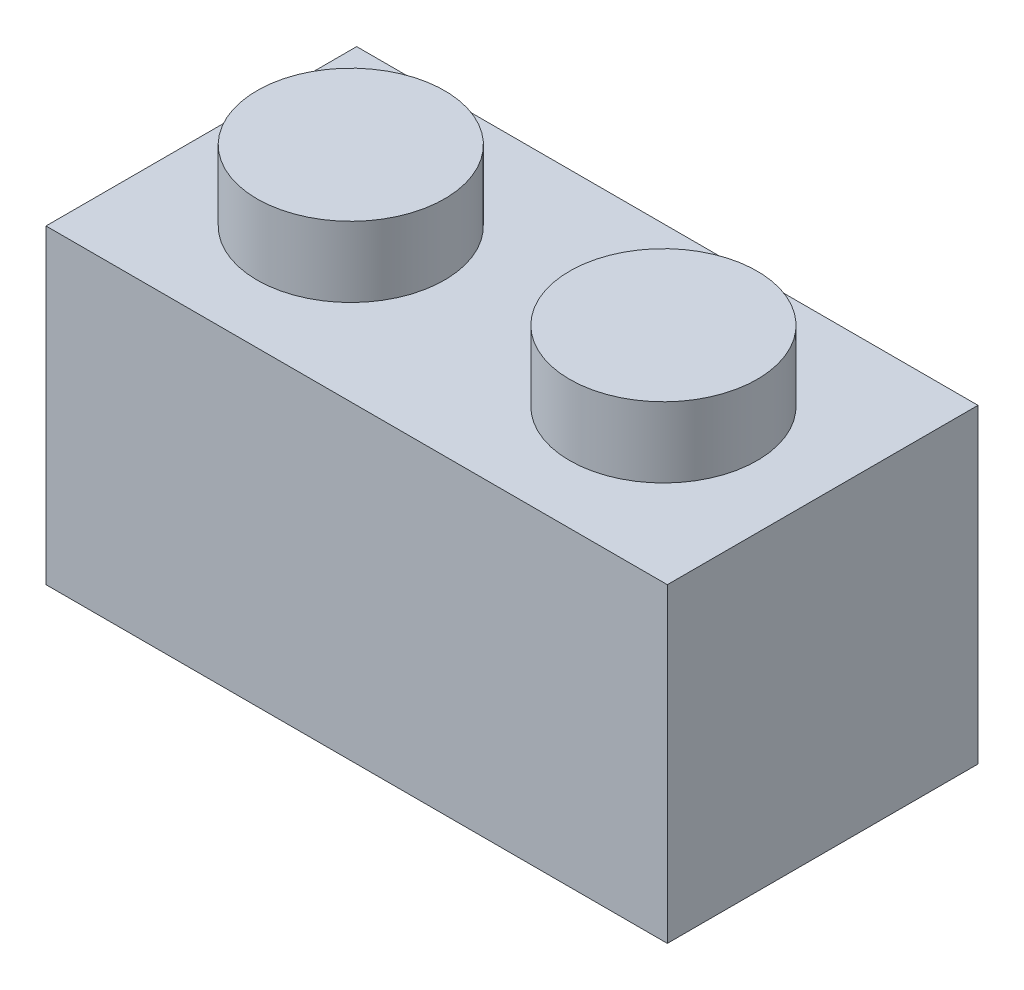
from build123d import *

# Parameters (mm, degrees)
SKETCH1_W           = 15.9
SKETCH1_H           = 7.95
BOSS_EXTRUDE1_DEPTH = 7.95
SKETCH2_R           = 2.4
BOSS_EXTRUDE2_DEPTH = 1.8
LPATTERN1_COUNT     = 2
LPATTERN1_PITCH     = 8
SHELL1_T            = -1.2


with BuildPart() as part:
    # Sketch1 → Boss-Extrude1 (new body)
    with BuildSketch(Plane.XY):
        Rectangle(SKETCH1_W, SKETCH1_H)
    extrude(amount=-BOSS_EXTRUDE1_DEPTH)

    # Sketch2 → Boss-Extrude2 (add)
    with BuildSketch(Plane(origin=(0, 3.975, 0), x_dir=(1, 0, 0), z_dir=(0, 1, 0))):
        with Locations(Location((-4.05, 3.9, 0), (0, 0, 270))):
            Circle(SKETCH2_R)
    boss_extrude2 = extrude(amount=BOSS_EXTRUDE2_DEPTH)

    # LPattern1: Boss-Extrude2 ×2
    with Locations(*[(i * LPATTERN1_PITCH, 0, 0) for i in range(1, LPATTERN1_COUNT)]):
        add(boss_extrude2)

    # Shell1
    shell1_openings = [part.faces().sort_by_distance(p)[0] for p in [
        (0, -3.975, -3.975),
    ]]
    offset(amount=SHELL1_T, openings=shell1_openings, kind=Kind.INTERSECTION)


solid = part.part
